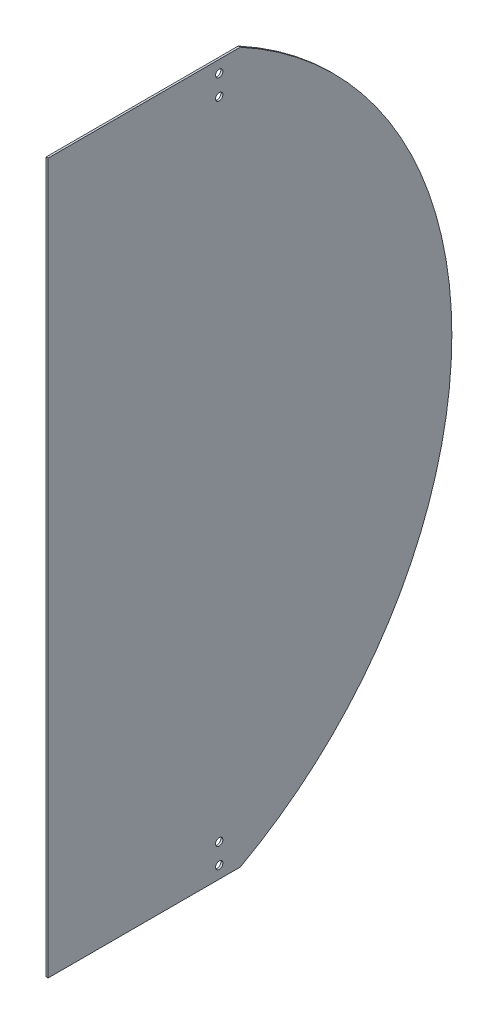
from build123d import *

# Parameters (mm, degrees)
BOSS_EXTRUDE1_DEPTH     = 2.5
SKETCH2_R               = 4.5
CUT_EXTRUDE1_DEPTH      = 10
LPATTERN1_COUNT         = 2
LPATTERN1_PITCH         = 25
MIRROR1_COPY_1_SKETCH_R = 4.5
MIRROR1_COPY_1_DEPTH    = 10


with BuildPart() as part:
    # Sketch1 → Boss-Extrude1 (new body)
    with BuildSketch(Plane(origin=(0, 0, 0), x_dir=(0, 0, -1), z_dir=(1, 0, 0))):
        with BuildLine():
            Line((0, 438), (236.981011898, 438))
            ThreePointArc((236.981011898, 438), (498, 0), (236.981011898, -438))
            Line((236.981011898, -438), (0, -438))
            Line((0, -438), (0, 438))
        make_face()
    extrude(amount=BOSS_EXTRUDE1_DEPTH)

    # Sketch2 → Cut-Extrude1 (cut)
    with BuildSketch(Plane(origin=(2.5, 0, 0), x_dir=(0, 0, -1), z_dir=(1, 0, 0))):
        with Locations((211, 423)):
            Circle(SKETCH2_R)
    cut_extrude1 = extrude(amount=-CUT_EXTRUDE1_DEPTH, mode=Mode.SUBTRACT)

    # LPattern1: Cut-Extrude1 ×2
    with Locations(*[(0, -i * LPATTERN1_PITCH, 0) for i in range(1, LPATTERN1_COUNT)]):
        add(cut_extrude1, mode=Mode.SUBTRACT)

    # Mirror1: Cut-Extrude1 across plane
    add(cut_extrude1.mirror(Plane.ZX), mode=Mode.SUBTRACT)

    # Mirror1 copy 1 sketch → Mirror1 copy 1 (cut)
    with BuildSketch(Plane(origin=(2.5, 25, 0), x_dir=(0, 0, -1), z_dir=(1, 0, 0))):
        with Locations((211, -423)):
            Circle(MIRROR1_COPY_1_SKETCH_R)
    extrude(amount=-MIRROR1_COPY_1_DEPTH, mode=Mode.SUBTRACT)


solid = part.part
